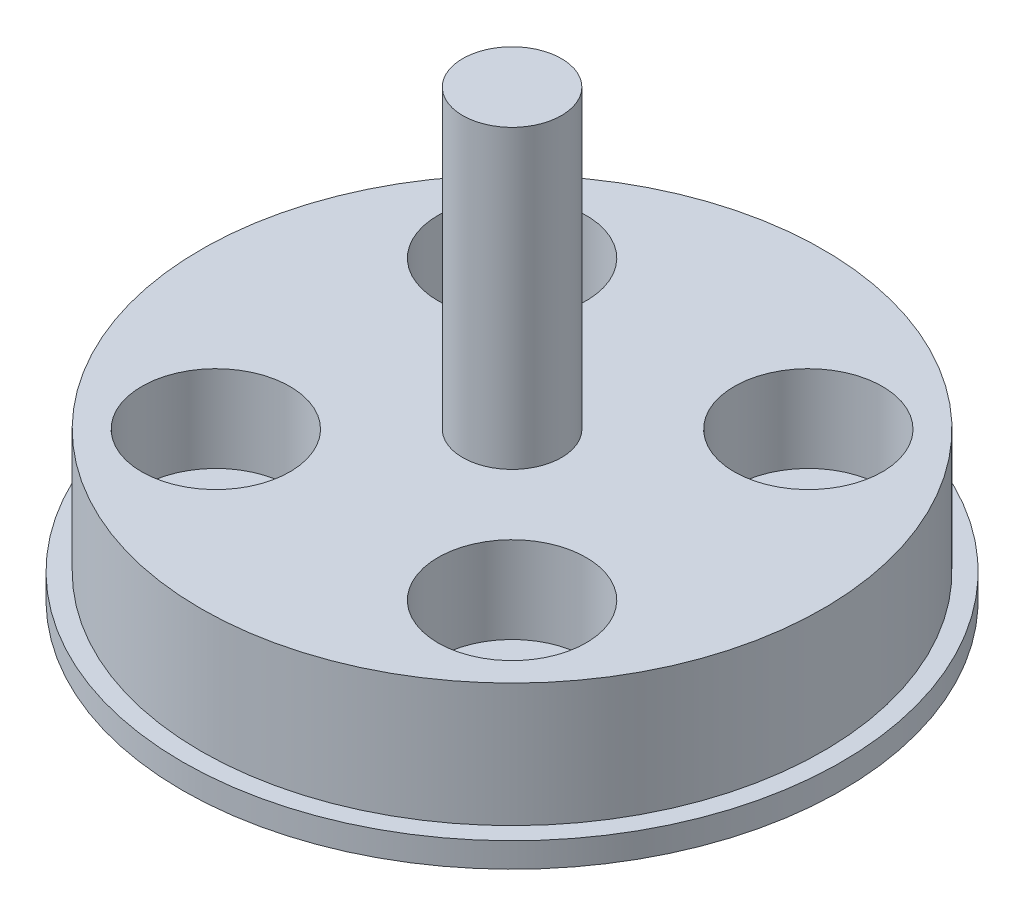
from build123d import *

# Parameters (mm, degrees)
SKETCH1_R           = 13.35
SKETCH1_R_2         = 1.575
BOSS_EXTRUDE1_DEPTH = 1
SKETCH1_3_R         = 12.6
SKETCH1_3_R_2       = 1.575
BOSS_EXTRUDE2_DEPTH = 6
SKETCH2_R           = 3
CUT_EXTRUDE1_DEPTH  = 3.5
SKETCH3_R           = 2
BOSS_EXTRUDE3_DEPTH = 12


with BuildPart() as part:
    # Sketch1 → Boss-Extrude1 (new body)
    with BuildSketch(Plane(origin=(0, 33, 0), x_dir=(1, 0, 0), z_dir=(0, 1, 0))):
        Circle(SKETCH1_R)
        with Locations((-6, -6)):
            Circle(SKETCH1_R_2, mode=Mode.SUBTRACT)
        with Locations((6, -6)):
            Circle(SKETCH1_R_2, mode=Mode.SUBTRACT)
        with Locations((-6, 6)):
            Circle(SKETCH1_R_2, mode=Mode.SUBTRACT)
        with Locations((6, 6)):
            Circle(SKETCH1_R_2, mode=Mode.SUBTRACT)
    extrude(amount=BOSS_EXTRUDE1_DEPTH)

    # Sketch1<3> → Boss-Extrude2 (add)
    with BuildSketch(Plane(origin=(0, 33, 0), x_dir=(1, 0, 0), z_dir=(0, 1, 0))):
        Circle(SKETCH1_3_R)
        with Locations((-6, -6)):
            Circle(SKETCH1_3_R_2, mode=Mode.SUBTRACT)
        with Locations((6, -6)):
            Circle(SKETCH1_3_R_2, mode=Mode.SUBTRACT)
        with Locations((-6, 6)):
            Circle(SKETCH1_3_R_2, mode=Mode.SUBTRACT)
        with Locations((6, 6)):
            Circle(SKETCH1_3_R_2, mode=Mode.SUBTRACT)
    extrude(amount=BOSS_EXTRUDE2_DEPTH)

    # Sketch2 → Cut-Extrude1 (cut)
    with BuildSketch(Plane(origin=(0, 39, 0), x_dir=(1, 0, 0), z_dir=(0, 1, 0))):
        with Locations((-6, 6)):
            Circle(SKETCH2_R)
        with Locations((6, 6)):
            Circle(SKETCH2_R)
        with Locations((6, -6)):
            Circle(SKETCH2_R)
        with Locations((-6, -6)):
            Circle(SKETCH2_R)
    extrude(amount=-CUT_EXTRUDE1_DEPTH, mode=Mode.SUBTRACT)

    # Sketch3 → Boss-Extrude3 (add)
    with BuildSketch(Plane(origin=(0, 39, 0), x_dir=(1, 0, 0), z_dir=(0, 1, 0))):
        Circle(SKETCH3_R)
    extrude(amount=BOSS_EXTRUDE3_DEPTH)


solid = part.part
